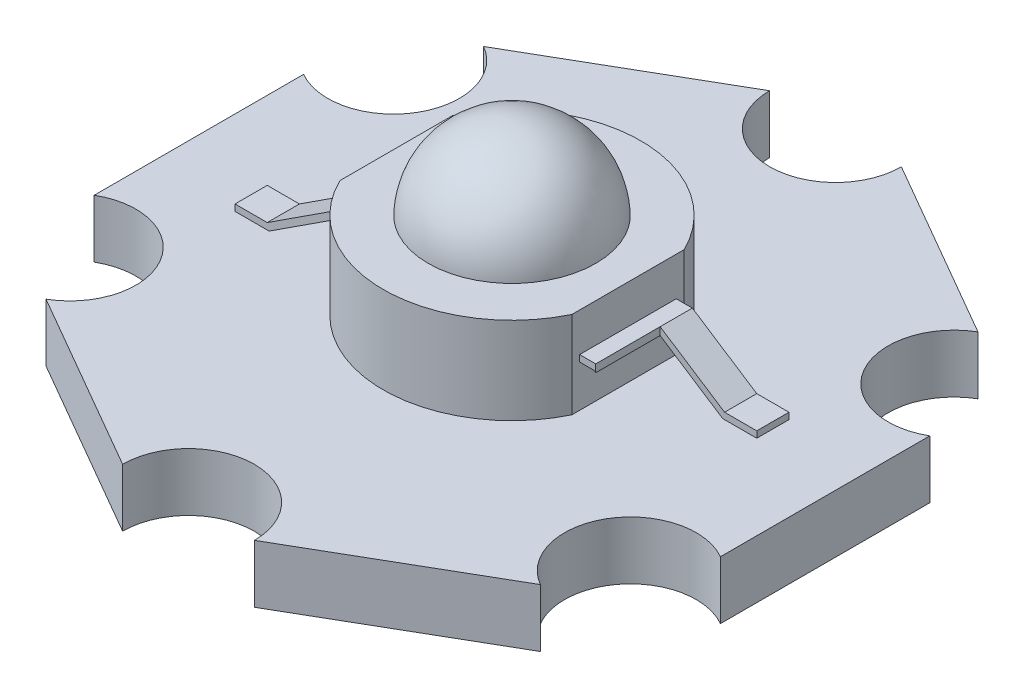
from build123d import *

# Parameters (mm, degrees)
BOSS_EXTRUDE1_DEPTH      = 1.8
SKETCH2_R                = 4
BOSS_EXTRUDE2_DEPTH      = 2.7
CUT_EXTRUDE1_DEPTH       = 2.7
BOSS_EXTRUDE3_DEPTH      = 1.5
BOSS_EXTRUDE3_DEPTH_BACK = 1.5
CUT_EXTRUDE2_START       = -1.5
SKETCH6_W                = 3
SKETCH6_H                = 2
CUT_EXTRUDE2_DEPTH       = 1.5


with BuildPart() as part:
    # Sketch1 → Boss-Extrude1 (new body)
    with BuildSketch(Plane(origin=(0, 0, 0), x_dir=(1, 0, 0), z_dir=(0, 1, 0))):
        with BuildLine():
            Line((-9.721111048, 3.25), (-9.721111048, 0))
            Line((-9.721111048, 0), (-9.721111048, -3.25))
            ThreePointArc((-9.721111048, -3.25), (-6.92820323, -4), (-7.675138086, -6.79372912))
            Line((-7.675138086, -6.79372912), (-4.860555524, -8.41872912))
            Line((-4.860555524, -8.41872912), (-2.045972962, -10.04372912))
            ThreePointArc((-2.045972962, -10.04372912), (0, -8), (2.045972962, -10.04372912))
            Line((2.045972962, -10.04372912), (4.860555524, -8.41872912))
            Line((4.860555524, -8.41872912), (7.675138086, -6.79372912))
            ThreePointArc((7.675138086, -6.79372912), (6.92820323, -4), (9.721111048, -3.25))
            Line((9.721111048, -3.25), (9.721111048, 0))
            Line((9.721111048, 0), (9.721111048, 3.25))
            ThreePointArc((9.721111048, 3.25), (6.92820323, 4), (7.675138086, 6.79372912))
            Line((7.675138086, 6.79372912), (4.860555524, 8.41872912))
            Line((4.860555524, 8.41872912), (2.045972962, 10.04372912))
            ThreePointArc((2.045972962, 10.04372912), (0, 8), (-2.045972962, 10.04372912))
            Line((-2.045972962, 10.04372912), (-4.860555524, 8.41872912))
            Line((-4.860555524, 8.41872912), (-7.675138086, 6.79372912))
            ThreePointArc((-7.675138086, 6.79372912), (-6.92820323, 4), (-9.721111048, 3.25))
        make_face()
    extrude(amount=BOSS_EXTRUDE1_DEPTH)

    # Sketch2 → Boss-Extrude2 (add)
    with BuildSketch(Plane(origin=(0, 1.8, 0), x_dir=(1, 0, 0), z_dir=(0, 1, 0))):
        with Locations(Location((0, 0, 0), (0, 0, 90))):
            Circle(SKETCH2_R)
    extrude(amount=BOSS_EXTRUDE2_DEPTH)

    # Sketch3 → Cut-Extrude1 (cut)
    with BuildSketch(Plane(origin=(0, 4.5, 0), x_dir=(1, 0, 0), z_dir=(0, 1, 0))):
        Polygon((-3.6, 5.061910399), (-3.6, -4.956827899), (3.6, -4.956827899), (3.6, 5.287050586), (4.769441753, 5.287050586), (4.769441753, -6.054386309), (-4.641273363, -6.054386309), (-4.641273363, 5.061910399), align=None)
    extrude(amount=-CUT_EXTRUDE1_DEPTH, mode=Mode.SUBTRACT)

    # Sketch4 → Revolve1 (revolve)
    with BuildSketch(Plane(origin=(0, 0, 0), x_dir=(0, 0, -1), z_dir=(1, 0, 0))):
        with BuildLine():
            Line((0, 7), (0, 4.5))
            Line((0, 4.5), (2.6, 4.5))
            ThreePointArc((2.6, 4.5), (1.80346888, 6.273607635), (0, 7))
        make_face()
    revolve(axis=Axis((0, 0, 0), (0, 1, 0)))

    # Sketch5 → Boss-Extrude3 (add, two sides: drawn at the far end of the back side and taken through both)
    with BuildSketch(Plane.XY.offset(-BOSS_EXTRUDE3_DEPTH_BACK)):
        Polygon((3.6, 3.3), (3.6, 3.1), (4.040711986, 3.1), (6.040711986, 1.8), (7.1, 1.8), (7.1, 2), (6.1, 2), (4.1, 3.3), align=None)
        Polygon((-7.1, 1.8), (-7.1, 2), (-6.1, 2), (-4.1, 3.3), (-3.6, 3.3), (-3.6, 3.1), (-4.040711986, 3.1), (-6.040711986, 1.8), align=None)
    extrude(amount=BOSS_EXTRUDE3_DEPTH + BOSS_EXTRUDE3_DEPTH_BACK)

    # Sketch6 → Cut-Extrude2 (cut)
    with BuildSketch(Plane(origin=(0, 3.3, 0), x_dir=(1, 0, 0), z_dir=(0, 1, 0)).offset(CUT_EXTRUDE2_START)):
        with Locations((-5.6, 0.5)):
            Rectangle(SKETCH6_W, SKETCH6_H)
        with Locations((5.6, -0.5)):
            Rectangle(SKETCH6_W, SKETCH6_H)
    extrude(amount=CUT_EXTRUDE2_DEPTH, mode=Mode.SUBTRACT)


solid = part.part
